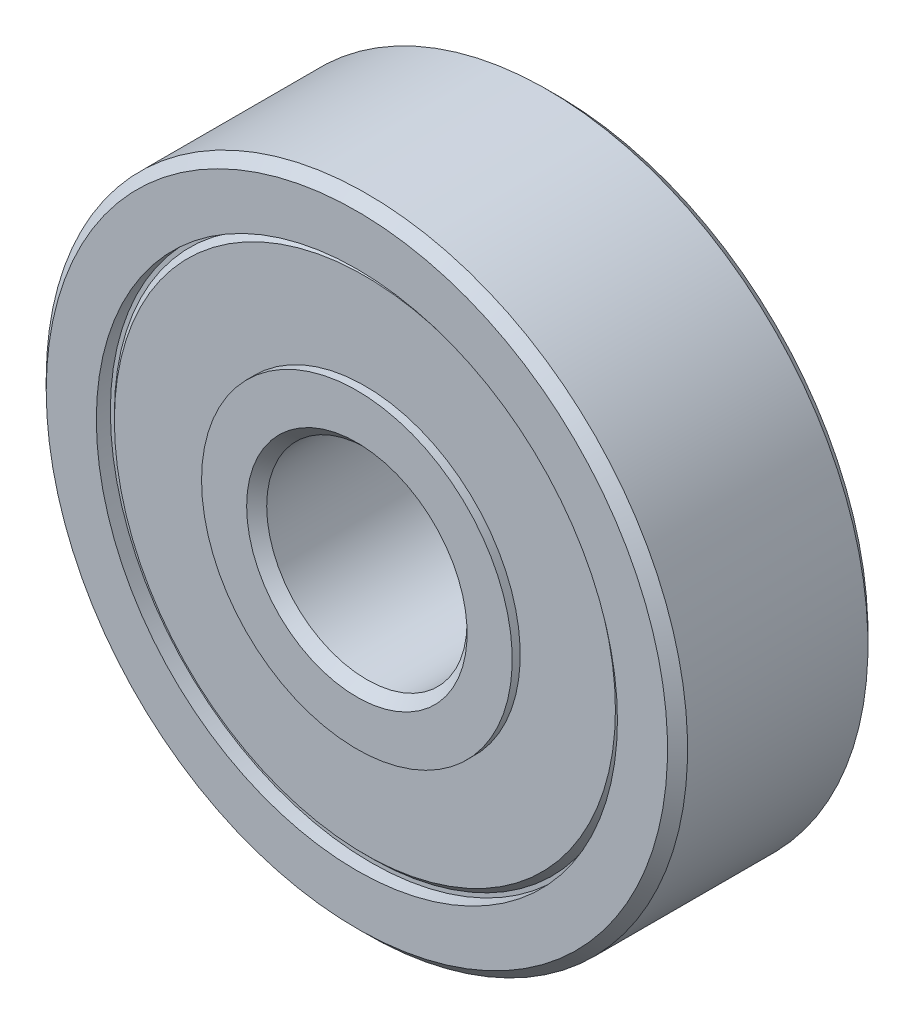
from build123d import *


with BuildPart() as part:
    # Sketch1 → Revolve1 (revolve)
    with BuildSketch(Plane(origin=(0, 0, 0), x_dir=(1, 0, 0), z_dir=(0, 1, 0)), mode=Mode.PRIVATE) as revolve1_sk:
        Polygon((2.5, -2.25), (2.5, 2.25), (2.75, 2.5), (3.875, 2.5), (3.875, 2.3), (6.25, 2.3), (6.4, 2.15), (6.5, 2.15), (6.5, 2.5), (7.75, 2.5), (8, 2.25), (8, -2.25), (7.75, -2.5), (6.5, -2.5), (6.5, -2.15), (6.4, -2.15), (6.25, -2.3), (3.875, -2.3), (3.875, -2.5), (2.75, -2.5), align=None)
    revolve(revolve1_sk.sketch.rotate(Axis((0, 0, -5.345688484), (0, 0, 1)), 180), axis=Axis((0, 0, -5.345688484), (0, 0, 1)))


solid = part.part
